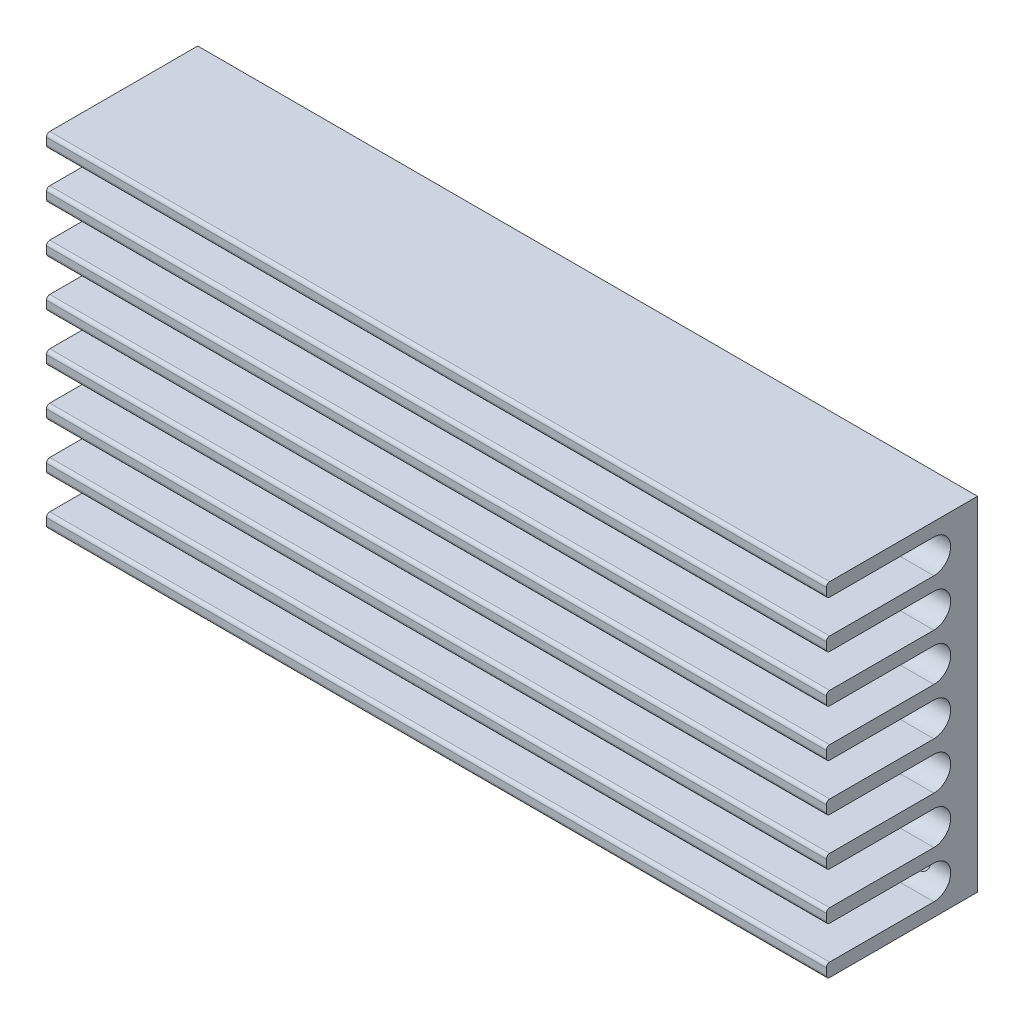
from build123d import *

# Parameters (mm, degrees)
SKETCH1_W           = 22.5
SKETCH1_H           = 51
BOSS_EXTRUDE1_DEPTH = 58
CUT_EXTRUDE1_REACH  = 121.301
LPATTERN1_COUNT     = 4
LPATTERN1_PITCH     = 7
LPATTERN1_COL_COUNT = 4
LPATTERN1_COL_PITCH = 7
FILLET1_R           = 0.5
CUT_EXTRUDE2_REACH  = 69.235
SKETCH3_R           = 1


with BuildPart() as part:
    # Sketch1 → Boss-Extrude1 (new, symmetric)
    with BuildSketch(Plane(origin=(0, 0, 0), x_dir=(0, 0, -1), z_dir=(1, 0, 0))):
        Rectangle(SKETCH1_W, SKETCH1_H)
    extrude(amount=BOSS_EXTRUDE1_DEPTH, both=True)

    # Sketch2 → Cut-Extrude1 (cut, up to next)
    with BuildSketch(Plane.ZY.offset(58), mode=Mode.PRIVATE) as cut_extrude1_sk1:
        with BuildLine():
            Line((-4.75, 2.5), (11.25, 2.5))
            Line((11.25, 2.5), (11.25, -2.5))
            Line((11.25, -2.5), (-4.75, -2.5))
            ThreePointArc((-4.75, -2.5), (-7.25, 0), (-4.75, 2.5))
        make_face()
    cut_extrude1_tool1 = extrude(cut_extrude1_sk1.sketch, amount=-CUT_EXTRUDE1_REACH, mode=Mode.PRIVATE) & part.part
    cut_extrude1 = cut_extrude1_tool1.solids().sort_by_distance((-58, 0, 2.259586))[0]
    add(cut_extrude1, mode=Mode.SUBTRACT)

    # LPattern1: Cut-Extrude1 ×4
    with Locations(*[(0, -i * LPATTERN1_PITCH, 0) for i in range(1, LPATTERN1_COUNT)]):
        add(cut_extrude1, mode=Mode.SUBTRACT)

    # LPattern1 col: Cut-Extrude1 ×4
    with Locations(*[(0, i * LPATTERN1_COL_PITCH, 0) for i in range(1, LPATTERN1_COL_COUNT)]):
        add(cut_extrude1, mode=Mode.SUBTRACT)

    # Fillet1
    fillet1_edges = [part.edges().sort_by_distance(p)[0] for p in [
        (0, 2.5, 11.25),
        (0, -2.5, 11.25),
        (0, 9.5, 11.25),
        (0, 4.5, 11.25),
        (0, -18.5, 11.25),
        (0, -23.5, 11.25),
        (0, -4.5, 11.25),
        (0, -9.5, 11.25),
        (0, 23.5, 11.25),
        (0, 18.5, 11.25),
        (0, -25.5, 11.25),
        (0, 25.5, 11.25),
        (0, 16.5, 11.25),
        (0, 11.5, 11.25),
        (0, -11.5, 11.25),
        (0, -16.5, 11.25),
    ]]
    fillet(fillet1_edges, radius=FILLET1_R)

    # Sketch3 → Cut-Extrude2 (cut, up to next)
    with BuildSketch(Plane(origin=(0, 0, -11.25), x_dir=(-1, 0, 0), z_dir=(0, 0, -1)), mode=Mode.PRIVATE) as cut_extrude2_sk1:
        with Locations(Location((-54, 21.5, 0), (0, 0, 90))):
            Circle(SKETCH3_R)
    cut_extrude2_tool1 = extrude(cut_extrude2_sk1.sketch, amount=-CUT_EXTRUDE2_REACH, mode=Mode.PRIVATE) & part.part
    # Sketch3 → Cut-Extrude2 (cut, up to next)
    with BuildSketch(Plane(origin=(0, 0, -11.25), x_dir=(-1, 0, 0), z_dir=(0, 0, -1)), mode=Mode.PRIVATE) as cut_extrude2_sk2:
        with Locations(Location((-54, -21.5, 0), (0, 0, 90))):
            Circle(SKETCH3_R)
    cut_extrude2_tool2 = extrude(cut_extrude2_sk2.sketch, amount=-CUT_EXTRUDE2_REACH, mode=Mode.PRIVATE) & part.part
    # Sketch3 → Cut-Extrude2 (cut, up to next)
    with BuildSketch(Plane(origin=(0, 0, -11.25), x_dir=(-1, 0, 0), z_dir=(0, 0, -1)), mode=Mode.PRIVATE) as cut_extrude2_sk3:
        with Locations(Location((54, -21.5, 0), (0, 0, 90))):
            Circle(SKETCH3_R)
    cut_extrude2_tool3 = extrude(cut_extrude2_sk3.sketch, amount=-CUT_EXTRUDE2_REACH, mode=Mode.PRIVATE) & part.part
    # Sketch3 → Cut-Extrude2 (cut, up to next)
    with BuildSketch(Plane(origin=(0, 0, -11.25), x_dir=(-1, 0, 0), z_dir=(0, 0, -1)), mode=Mode.PRIVATE) as cut_extrude2_sk4:
        with Locations(Location((54, 21.5, 0), (0, 0, 90))):
            Circle(SKETCH3_R)
    cut_extrude2_tool4 = extrude(cut_extrude2_sk4.sketch, amount=-CUT_EXTRUDE2_REACH, mode=Mode.PRIVATE) & part.part
    add(cut_extrude2_tool1.solids().sort_by_distance((54, 21.5, -11.25))[0], mode=Mode.SUBTRACT)
    add(cut_extrude2_tool2.solids().sort_by_distance((54, -21.5, -11.25))[0], mode=Mode.SUBTRACT)
    add(cut_extrude2_tool3.solids().sort_by_distance((-54, -21.5, -11.25))[0], mode=Mode.SUBTRACT)
    add(cut_extrude2_tool4.solids().sort_by_distance((-54, 21.5, -11.25))[0], mode=Mode.SUBTRACT)


solid = part.part
